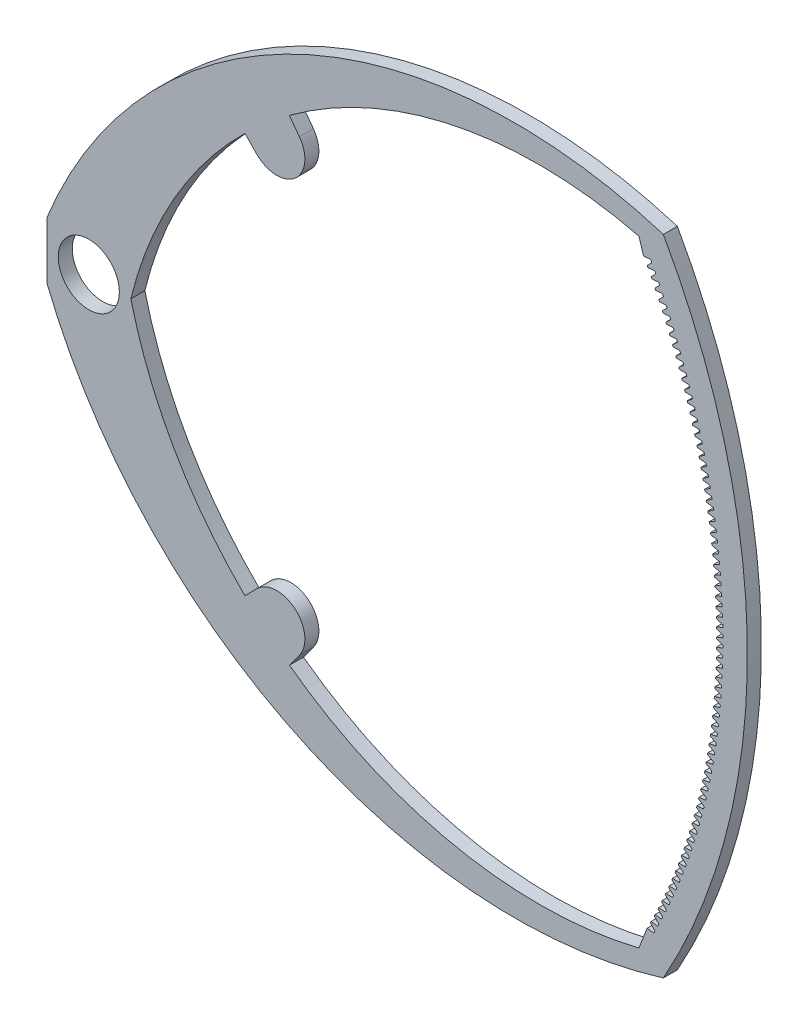
from build123d import *

# Parameters (mm, degrees)
SKETCH3_R           = 10.9
BOSS_EXTRUDE2_DEPTH = 5


with BuildPart() as part:
    # Sketch3 → Boss-Extrude2 (new body)
    with BuildSketch(Plane.XY):
        with BuildLine():
            Line((-15, -10), (-15, 10))
            ThreePointArc((-15, 10), (74.547676937, 105.343973254), (205.001324898, 114.888888889))
            ThreePointArc((205.001324898, 114.888888889), (235, 0), (205.001324898, -114.888888889))
            ThreePointArc((205.001324898, -114.888888889), (74.547676937, -105.343973254), (-15, -10))
        make_face()
        Circle(SKETCH3_R, mode=Mode.SUBTRACT)
        with BuildLine():
            Line((55.718333905, 71.437118146), (59.917032834, 67.150986171))
            ThreePointArc((59.917032834, 67.150986171), (73.578424615, 66.535062775), (75.141568824, 80.120701045))
            Line((75.141568824, 80.120701045), (71.577225561, 84.947237806))
            ThreePointArc((71.577225561, 84.947237806), (131.140675208, 111.345320133), (196.277864264, 110))
            Line((196.277864264, 110), (197.7802608, 105.161630064))
            ThreePointArc((197.7802608, 105.161630064), (197.927001001, 104.885186154), (198.073354808, 104.608537487))
            Line((198.073354808, 104.608537487), (200.443814177, 104.934931544))
            ThreePointArc((200.443814177, 104.934931544), (200.649821031, 104.540479338), (200.855051645, 104.145622705))
            Line((200.855051645, 104.145622705), (199.229267617, 102.389935661))
            ThreePointArc((199.229267617, 102.389935661), (199.372133755, 102.111469885), (199.514610677, 101.832804766))
            Line((199.514610677, 101.832804766), (201.889396156, 102.126070226))
            ThreePointArc((201.889396156, 102.126070226), (202.089875516, 101.728780165), (202.289573066, 101.331096554))
            Line((202.289573066, 101.331096554), (200.639434294, 99.598280137))
            ThreePointArc((200.639434294, 99.598280137), (200.778398516, 99.317846782), (200.916970777, 99.037219538))
            Line((200.916970777, 99.037219538), (203.295619397, 99.297299229))
            ThreePointArc((203.295619397, 99.297299229), (203.490532179, 98.897248765), (203.684657734, 98.496815705))
            Line((203.684657734, 98.496815705), (202.010485915, 96.787207732))
            ThreePointArc((202.010485915, 96.787207732), (202.14552113, 96.504861468), (202.280161716, 96.222326807))
            Line((202.280161716, 96.222326807), (204.662209754, 96.449170026))
            ThreePointArc((204.662209754, 96.449170026), (204.851517961, 96.04643715), (205.040033673, 95.643332707))
            Line((205.040033673, 95.643332707), (203.342155191, 93.957266468))
            ThreePointArc((203.342155191, 93.957266468), (203.473235075, 93.67306234), (203.603917736, 93.388675344))
            Line((203.603917736, 93.388675344), (205.988900808, 93.582237867))
            ThreePointArc((205.988900808, 93.582237867), (206.172567532, 93.176901092), (206.355436652, 92.771203851))
            Line((206.355436652, 92.771203851), (204.634182512, 91.109008049))
            ThreePointArc((204.634182512, 91.109008049), (204.761281509, 90.823001464), (204.887980769, 90.536817573))
            Line((204.887980769, 90.536817573), (207.275433917, 90.697061664))
            ThreePointArc((207.275433917, 90.697061664), (207.453423354, 90.289200012), (207.63061023, 89.880989066))
            Line((207.63061023, 89.880989066), (205.886315993, 88.242987748))
            ThreePointArc((205.886315993, 88.242987748), (206.009409325, 87.955234463), (206.132100485, 87.66730947))
            Line((206.132100485, 87.66730947), (208.52155827, 87.79420389))
            ThreePointArc((208.52155827, 87.79420389), (208.693835719, 87.383896874), (208.865305809, 86.973251803))
            Line((208.865305809, 86.973251803), (207.098311529, 85.359764302))
            ThreePointArc((207.098311529, 85.359764302), (207.2173752, 85.070320414), (207.336034339, 84.780710452))
            Line((207.336034339, 84.780710452), (209.727030932, 84.874230462))
            ThreePointArc((209.727030932, 84.874230462), (209.893562807, 84.461558073), (210.059282683, 84.048558933))
            Line((210.059282683, 84.048558933), (208.269932839, 82.459899801))
            ThreePointArc((208.269932839, 82.459899801), (208.384943636, 82.168821739), (208.499547622, 81.877583266))
            Line((208.499547622, 81.877583266), (210.891616894, 81.937710634))
            ThreePointArc((210.891616894, 81.937710634), (211.05237073, 81.522753323), (211.212308083, 81.10748063))
            Line((211.212308083, 81.10748063), (209.400951513, 79.543959579))
            ThreePointArc((209.400951513, 79.543959579), (209.511887014, 79.251304088), (209.622413505, 78.958493883))
            Line((209.622413505, 78.958493883), (212.015089117, 78.985216888))
            ThreePointArc((212.015089117, 78.985216888), (212.170033575, 78.56805555), (212.324157226, 78.150590262))
            Line((212.324157226, 78.150590262), (210.491147056, 76.612512105))
            ThreePointArc((210.491147056, 76.612512105), (210.597985635, 76.318336239), (210.704413084, 76.024011385))
            Line((210.704413084, 76.024011385), (213.097228578, 76.017324817))
            ThreePointArc((213.097228578, 76.017324817), (213.246333451, 75.59804078), (213.394613353, 75.178464283))
            Line((213.394613353, 75.178464283), (211.540306933, 73.666128869))
            ThreePointArc((211.540306933, 73.666128869), (211.643027762, 73.370489979), (211.745335419, 73.074707855))
            Line((211.745335419, 73.074707855), (214.137824313, 73.034613017))
            ThreePointArc((214.137824313, 73.034613017), (214.281060532, 72.613288022), (214.423467778, 72.191682112))
            Line((214.423467778, 72.191682112), (212.548226608, 70.705384276))
            ThreePointArc((212.548226608, 70.705384276), (212.646809661, 70.408339997), (212.744977582, 70.111158266))
            Line((212.744977582, 70.111158266), (215.136673454, 70.037662976))
            ThreePointArc((215.136673454, 70.037662976), (215.274013096, 69.614379159), (215.410519922, 69.19082603))
            Line((215.410519922, 69.19082603), (213.514709586, 67.730855528))
            ThreePointArc((213.514709586, 67.730855528), (213.609135643, 67.432463769), (213.70314469, 67.133940369))
            Line((213.70314469, 67.133940369), (216.093581275, 67.027058953))
            ThreePointArc((216.093581275, 67.027058953), (216.224997564, 66.601898835), (216.355577359, 66.17648106))
            Line((216.355577359, 66.17648106), (214.439567447, 64.743122516))
            ThreePointArc((214.439567447, 64.743122516), (214.5298181, 64.443441449), (214.619649947, 64.143634576))
            Line((214.619649947, 64.143634576), (217.008361224, 64.003387872))
            ThreePointArc((217.008361224, 64.003387872), (217.133828541, 63.576434339), (217.258455848, 63.149234854))
            Line((217.258455848, 63.149234854), (215.32261989, 61.742767703))
            ThreePointArc((215.32261989, 61.742767703), (215.408677545, 61.441855753), (215.494314678, 61.140823855))
            Line((215.494314678, 61.140823855), (217.880834962, 60.967239204))
            ThreePointArc((217.880834962, 60.967239204), (218.000328847, 60.538575492), (218.11897937, 60.109677579))
            Line((218.11897937, 60.109677579), (216.163694762, 58.730376016))
            ThreePointArc((216.163694762, 58.730376016), (216.245542641, 58.428291844), (216.326968364, 58.126093609))
            Line((216.326968364, 58.126093609), (218.710832401, 57.919204852))
            ThreePointArc((218.710832401, 57.919204852), (218.824329558, 57.488914529), (218.936980165, 57.058401803))
            Line((218.936980165, 57.058401803), (216.962628093, 55.706534725))
            ThreePointArc((216.962628093, 55.706534725), (217.04025024, 55.403337225), (217.11744868, 55.100031566))
            Line((217.11744868, 55.100031566), (219.498191729, 54.859879036))
            ThreePointArc((219.498191729, 54.859879036), (219.605670031, 54.428045988), (219.712298762, 53.996002379))
            Line((219.712298762, 53.996002379), (217.71926413, 52.671833335))
            ThreePointArc((217.71926413, 52.671833335), (217.792645413, 52.367581615), (217.865601519, 52.063227662))
            Line((217.865601519, 52.063227662), (220.24275945, 51.789858177))
            ThreePointArc((220.24275945, 51.789858177), (220.344197945, 51.356566592), (220.44478401, 50.923076327))
            Line((220.44478401, 50.923076327), (218.433455364, 49.626863467))
            ThreePointArc((218.433455364, 49.626863467), (218.502581477, 49.321616841), (218.571281028, 49.01627393))
            Line((218.571281028, 49.01627393), (220.944390408, 48.709740784))
            ThreePointArc((220.944390408, 48.709740784), (221.03976932, 48.275075131), (221.134293112, 47.84022272))
            Line((221.134293112, 47.84022272), (219.105062564, 46.572218743))
            ThreePointArc((219.105062564, 46.572218743), (219.16992003, 46.266036721), (219.234349632, 45.959764377))
            Line((219.234349632, 45.959764377), (221.60294782, 45.62012733))
            ThreePointArc((221.60294782, 45.62012733), (221.692248554, 45.184172349), (221.780691645, 44.748042568))
            Line((221.780691645, 44.748042568), (219.733954798, 43.508494673))
            ThreePointArc((219.733954798, 43.508494673), (219.794530974, 43.201436944), (219.854678065, 42.894294877))
            Line((219.854678065, 42.894294877), (222.218303298, 42.521620142))
            ThreePointArc((222.218303298, 42.521620142), (222.301508446, 42.084460823), (222.383853592, 41.647138695))
            Line((222.383853592, 41.647138695), (220.320009462, 40.436288536))
            ThreePointArc((220.320009462, 40.436288536), (220.376292538, 40.128414963), (220.432145393, 39.82046305))
            Line((220.432145393, 39.82046305), (222.790336877, 39.414823279))
            ThreePointArc((222.790336877, 39.414823279), (222.867430217, 38.976544848), (222.943661367, 38.538115631))
            Line((222.943661367, 38.538115631), (220.863112304, 37.356199264))
            ThreePointArc((220.863112304, 37.356199264), (220.915091307, 37.047569867), (220.966639037, 36.738868144))
            Line((220.966639037, 36.738868144), (223.318937039, 36.300342419))
            ThreePointArc((223.318937039, 36.300342419), (223.389903542, 35.861030318), (223.460005833, 35.421579484))
            Line((223.460005833, 35.421579484), (221.363157444, 34.268827328))
            ThreePointArc((221.363157444, 34.268827328), (221.410822241, 33.959502274), (221.458054798, 33.650110924))
            Line((221.458054798, 33.650110924), (223.804000732, 33.178784735))
            ThreePointArc((223.804000732, 33.178784735), (223.868826562, 32.738524609), (223.932786328, 32.298137831))
            Line((223.932786328, 32.298137831), (221.820047398, 31.174774615))
            ThreePointArc((221.820047398, 31.174774615), (221.863388696, 30.864814208), (221.906296872, 30.554793547))
            Line((221.906296872, 30.554793547), (224.245433391, 30.050758781))
            ThreePointArc((224.245433391, 30.050758781), (224.304105911, 29.609636461), (224.361910683, 29.168399591))
            Line((224.361910683, 29.168399591), (222.233693094, 28.074644318))
            ThreePointArc((222.233693094, 28.074644318), (222.272702445, 27.764108986), (222.311277873, 27.453519453))
            Line((222.311277873, 27.453519453), (224.643148959, 26.916874373))
            ThreePointArc((224.643148959, 26.916874373), (224.69565673, 26.474975854), (224.747295239, 26.032974914))
            Line((224.747295239, 26.032974914), (222.604013892, 24.969040814))
            ThreePointArc((222.604013892, 24.969040814), (222.63868369, 24.657991096), (222.672918851, 24.346893241))
            Line((222.672918851, 24.346893241), (224.997069899, 23.777742466))
            ThreePointArc((224.997069899, 23.777742466), (225.043402686, 23.335153899), (225.088864864, 22.892475057))
            Line((225.088864864, 22.892475057), (222.930937596, 21.858569546))
            ThreePointArc((222.930937596, 21.858569546), (222.961261082, 21.547066082), (222.991149302, 21.235520554))
            Line((222.991149302, 21.235520554), (225.307127215, 20.633975041))
            ThreePointArc((225.307127215, 20.633975041), (225.347275984, 20.19078271), (225.386552969, 19.747512267))
            Line((225.386552969, 19.747512267), (223.214400472, 18.743836906))
            ThreePointArc((223.214400472, 18.743836906), (223.240371735, 18.431940425), (223.265907186, 18.12000796))
            Line((223.265907186, 18.12000796), (225.57326046, 17.486184982))
            ThreePointArc((225.57326046, 17.486184982), (225.607217385, 17.042475287), (225.640301519, 16.59869966))
            Line((225.640301519, 16.59869966), (223.454347258, 15.625450119))
            ThreePointArc((223.454347258, 15.625450119), (223.475961234, 15.313221424), (223.497138939, 15.000962834))
            Line((223.497138939, 15.000962834), (225.795417752, 14.334985957))
            ThreePointArc((225.795417752, 14.334985957), (225.823176211, 13.8908454), (225.850061045, 13.446651104))
            Line((225.850061045, 13.446651104), (223.650731177, 12.504017118))
            ThreePointArc((223.650731177, 12.504017118), (223.667983653, 12.19151708), (223.684799483, 11.878993241))
            Line((223.684799483, 11.878993241), (225.973555779, 11.180992297))
            ThreePointArc((225.973555779, 11.180992297), (225.995110362, 10.736507465), (226.015790654, 10.291981097))
            Line((226.015790654, 10.291981097), (223.803513942, 9.380146435))
            ThreePointArc((223.803513942, 9.380146435), (223.816401555, 9.067435976), (223.828852231, 8.754707815))
            Line((223.828852231, 8.754707815), (226.107639813, 8.024818881))
            ThreePointArc((226.107639813, 8.024818881), (226.122986318, 7.580076426), (226.137458037, 7.135304647))
            Line((226.137458037, 7.135304647), (223.912665769, 6.254447074))
            ThreePointArc((223.912665769, 6.254447074), (223.921186005, 5.941587157), (223.929269101, 5.628715642))
            Line((223.929269101, 5.628715642), (226.197643715, 4.867081011))
            ThreePointArc((226.197643715, 4.867081011), (226.20677915, 4.422167637), (226.215039475, 3.977237155))
            Line((226.215039475, 3.977237155), (223.978165378, 3.127528396))
            ThreePointArc((223.978165378, 3.127528396), (223.982316577, 2.814580015), (223.986030517, 2.501626139))
            Line((223.986030517, 2.501626139), (226.243549939, 1.708394294))
            ThreePointArc((226.243549939, 1.708394294), (226.246472522, 1.263396738), (226.248519842, 0.818394294))
            Line((226.248519842, 0.818394294), (224, 0))
            ThreePointArc((224, 0), (223.999781353, -0.312975836), (223.999125412, -0.625951061))
            Line((223.999125412, -0.625951061), (226.245349534, -1.450625479))
            ThreePointArc((226.245349534, -1.450625479), (226.242058696, -1.895620464), (226.237892612, -2.340608116))
            Line((226.237892612, -2.340608116), (223.978165378, -3.127528396))
            ThreePointArc((223.978165378, -3.127528396), (223.973576927, -3.440470672), (223.968551234, -3.753406231))
            Line((223.968551234, -3.753406231), (226.20304215, -4.609362448))
            ThreePointArc((226.20304215, -4.609362448), (226.193538533, -5.05426811), (226.183159857, -5.499154219))
            Line((226.183159857, -5.499154219), (223.912665769, -6.254447074))
            ThreePointArc((223.912665769, -6.254447074), (223.903708409, -6.567294781), (223.894313942, -6.880129667))
            Line((223.894313942, -6.880129667), (226.116636034, -7.767200814))
            ThreePointArc((226.116636034, -7.767200814), (226.10092149, -8.211930417), (226.084332246, -8.656628251))
            Line((226.084332246, -8.656628251), (223.803513942, -9.380146435))
            ThreePointArc((223.803513942, -9.380146435), (223.790189419, -9.692838583), (223.776428011, -10.005511807))
            Line((223.776428011, -10.005511807), (225.986148033, -10.923524948))
            ThreePointArc((225.986148033, -10.923524948), (225.964225626, -11.367991791), (225.941429047, -11.812414656))
            Line((225.941429047, -11.812414656), (223.650731177, -12.504017118))
            ThreePointArc((223.650731177, -12.504017118), (223.633042088, -12.816492746), (223.614916422, -13.128943354))
            Line((223.614916422, -13.128943354), (225.811603584, -14.07771952))
            ThreePointArc((225.811603584, -14.07771952), (225.783477587, -14.521836954), (225.754478119, -14.965898208))
            Line((225.754478119, -14.965898208), (223.454347258, -15.625450119))
            ThreePointArc((223.454347258, -15.625450119), (223.432297053, -15.937648309), (223.409810662, -16.249815387))
            Line((223.409810662, -16.249815387), (225.593036715, -17.229169612))
            ThreePointArc((225.593036715, -17.229169612), (225.558712613, -17.672851055), (225.523515908, -18.116464128))
            Line((225.523515908, -18.116464128), (223.214400472, -18.743836906))
            ThreePointArc((223.214400472, -18.743836906), (223.187993449, -19.055696796), (223.161150716, -19.367519486))
            Line((223.161150716, -19.367519486), (225.330490037, -20.377260844))
            ThreePointArc((225.330490037, -20.377260844), (225.28997452, -20.820419799), (225.248587441, -21.263498207))
            Line((225.248587441, -21.263498207), (222.930937596, -21.858569546))
            ThreePointArc((222.930937596, -21.858569546), (222.900178903, -22.170030338), (222.868985062, -22.481447849))
            Line((222.868985062, -22.481447849), (225.024014734, -23.521379488))
            ThreePointArc((225.024014734, -23.521379488), (224.977315701, -23.963929561), (224.929746315, -24.406386926))
            Line((224.929746315, -24.406386926), (222.604013892, -24.969040814))
            ThreePointArc((222.604013892, -24.969040814), (222.568909525, -25.280041787), (222.533370658, -25.590993409))
            Line((222.533370658, -25.590993409), (224.673670553, -26.660912592))
            ThreePointArc((224.673670553, -26.660912592), (224.620797108, -27.102767507), (224.567054689, -27.544517571))
            Line((224.567054689, -27.544517571), (222.233693094, -28.074644318))
            ThreePointArc((222.233693094, -28.074644318), (222.194249898, -28.385124843), (222.154372932, -28.695549954))
            Line((222.154372932, -28.695549954), (224.279525795, -29.795248099))
            ThreePointArc((224.279525795, -29.795248099), (224.220488246, -30.236321715), (224.160583271, -30.677278357))
            Line((224.160583271, -30.677278357), (221.820047398, -31.174774615))
            ThreePointArc((221.820047398, -31.174774615), (221.776273061, -31.484674162), (221.732065771, -31.794512245))
            Line((221.732065771, -31.794512245), (223.841657299, -32.923774964))
            ThreePointArc((223.841657299, -32.923774964), (223.776467155, -33.363981292), (223.710411304, -33.804058548))
            Line((223.710411304, -33.804058548), (221.363157444, -34.268827328))
            ThreePointArc((221.363157444, -34.268827328), (221.315060501, -34.578085482), (221.266531505, -34.887276132))
            Line((221.266531505, -34.887276132), (223.360150428, -36.045883273))
            ThreePointArc((223.360150428, -36.045883273), (223.288820398, -36.485136495), (223.216626548, -36.92424857))
            Line((223.216626548, -36.92424857), (220.863112304, -37.356199264))
            ThreePointArc((220.863112304, -37.356199264), (220.810702131, -37.664755735), (220.757860889, -37.973238676))
            Line((220.757860889, -37.973238676), (222.835099053, -39.160964365))
            ThreePointArc((222.835099053, -39.160964365), (222.757643044, -39.599178848), (222.679325269, -40.037240137))
            Line((222.679325269, -40.037240137), (220.320009462, -40.436288536))
            ThreePointArc((220.320009462, -40.436288536), (220.263296277, -40.74408317), (220.206153092, -41.051798262))
            Line((220.206153092, -41.051798262), (222.266605534, -42.26841095))
            ThreePointArc((222.266605534, -42.26841095), (222.183038646, -42.705501263), (222.098612214, -43.142426364))
            Line((222.098612214, -43.142426364), (219.733954798, -43.508494673))
            ThreePointArc((219.733954798, -43.508494673), (219.672949657, -43.815467465), (219.611515668, -44.122354719))
            Line((219.611515668, -44.122354719), (221.6547807, -45.367617225))
            ThreePointArc((221.6547807, -45.367617225), (221.565119224, -45.803498156), (221.474600595, -46.239201891))
            Line((221.474600595, -46.239201891), (219.105062564, -46.572218743))
            ThreePointArc((219.105062564, -46.572218743), (219.03977736, -46.878309847), (218.974064545, -47.184309435))
            Line((218.974064545, -47.184309435), (220.999743828, -48.457978993))
            ThreePointArc((220.999743828, -48.457978993), (220.904005243, -48.892565566), (220.807412063, -49.326962993))
            Line((220.807412063, -49.326962993), (218.433455364, -49.626863467))
            ThreePointArc((218.433455364, -49.626863467), (218.363902825, -49.93201321), (218.293923993, -50.237065476))
            Line((218.293923993, -50.237065476), (220.301622617, -51.538893781))
            ThreePointArc((220.301622617, -51.538893781), (220.199825588, -51.972101274), (220.097176689, -52.405107705))
            Line((220.097176689, -52.405107705), (217.71926413, -52.671833335))
            ThreePointArc((217.71926413, -52.671833335), (217.645457814, -52.975982229), (217.571226609, -53.280027702))
            Line((217.571226609, -53.280027702), (219.560553169, -54.609760961))
            ThreePointArc((219.560553169, -54.609760961), (219.452717542, -55.041504917), (219.344032934, -55.473035939))
            Line((219.344032934, -55.473035939), (216.962628093, -55.706534725))
            ThreePointArc((216.962628093, -55.706534725), (216.884582389, -56.009623474), (216.806113283, -56.312602882))
            Line((216.806113283, -56.312602882), (218.776679956, -57.669981859))
            ThreePointArc((218.776679956, -57.669981859), (218.662826753, -58.10017811), (218.548127625, -58.530149594))
            Line((218.548127625, -58.530149594), (216.163694762, -58.730376016))
            ThreePointArc((216.163694762, -58.730376016), (216.081424886, -59.032345533), (215.998733175, -59.334199807))
            Line((215.998733175, -59.334199807), (217.950155795, -60.71895988))
            ThreePointArc((217.950155795, -60.71895988), (217.830307213, -61.147524558), (217.709615926, -61.57585268))
            Line((217.709615926, -61.57585268), (215.32261989, -61.742767703))
            ThreePointArc((215.32261989, -61.742767703), (215.236141881, -62.043559119), (215.149243687, -62.344229413))
            Line((215.149243687, -62.344229413), (217.08114182, -63.756100619))
            ThreePointArc((217.08114182, -63.756100619), (216.955321223, -64.182950175), (216.828661306, -64.609551432))
            Line((216.828661306, -64.609551432), (214.439567447, -64.743122516))
            ThreePointArc((214.439567447, -64.743122516), (214.348898164, -65.04267719), (214.257810427, -65.342104887))
            Line((214.257810427, -65.342104887), (216.169807446, -66.78081198))
            ThreePointArc((216.169807446, -66.78081198), (216.038039363, -67.205863199), (215.905435509, -67.630654424))
            Line((215.905435509, -67.630654424), (213.514709586, -67.730855528))
            ThreePointArc((213.514709586, -67.730855528), (213.419866704, -68.029115062), (213.324607182, -68.327241789))
            Line((213.324607182, -68.327241789), (215.21633034, -69.79250429))
            ThreePointArc((215.21633034, -69.79250429), (215.078640459, -70.215674307), (214.940118519, -70.638572685))
            Line((214.940118519, -70.638572685), (212.548226608, -70.705384276))
            ThreePointArc((212.548226608, -70.705384276), (212.449228618, -71.002290524), (212.349815883, -71.29905816))
            Line((212.349815883, -71.29905816), (214.220896384, -72.790590413))
            ThreePointArc((214.220896384, -72.790590413), (214.077311548, -73.21179673), (213.932898527, -73.632719818))
            Line((213.932898527, -73.632719818), (211.540306933, -73.666128869))
            ThreePointArc((211.540306933, -73.666128869), (211.437173134, -73.961623948), (211.333626566, -74.256974638))
            Line((211.333626566, -74.256974638), (213.183699639, -75.774485865))
            ThreePointArc((213.183699639, -75.774485865), (213.034247841, -76.193646368), (212.883971893, -76.612512105))
            Line((212.883971893, -76.612512105), (210.491147056, -76.612512105))
            ThreePointArc((210.491147056, -76.612512105), (210.383897555, -76.906538407), (210.27623734, -77.200414572))
            Line((210.27623734, -77.200414572), (212.10494231, -78.743608932))
            ThreePointArc((212.10494231, -78.743608932), (211.949652685, -79.160641903), (211.793543107, -79.577368631))
            Line((211.793543107, -79.577368631), (209.400951513, -79.543959579))
            ThreePointArc((209.400951513, -79.543959579), (209.289607217, -79.836459784), (209.177854345, -80.128804131))
            Line((209.177854345, -80.128804131), (210.984834702, -81.697380776))
            ThreePointArc((210.984834702, -81.697380776), (210.823737525, -82.112204915), (210.66182475, -82.526711392))
            Line((210.66182475, -82.526711392), (208.269932839, -82.459899801))
            ThreePointArc((208.269932839, -82.459899801), (208.154515456, -82.750816885), (208.038691713, -83.041572422))
            Line((208.038691713, -83.041572422), (209.823595183, -84.635225554))
            ThreePointArc((209.823595183, -84.635225554), (209.656721859, -85.047759989), (209.489037452, -85.459965407))
            Line((209.489037452, -85.459965407), (207.098311529, -85.359764302))
            ThreePointArc((207.098311529, -85.359764302), (206.97884356, -85.64904155), (206.858971526, -85.938151594))
            Line((206.858971526, -85.938151594), (208.621450138, -87.556570527))
            ThreePointArc((208.621450138, -87.556570527), (208.4488332, -87.966734835), (208.275409852, -88.376558832))
            Line((208.275409852, -88.376558832), (205.886315993, -88.242987748))
            ThreePointArc((205.886315993, -88.242987748), (205.762820728, -88.530568765), (205.638923772, -88.817976953))
            Line((205.638923772, -88.817976953), (207.378633928, -90.460846173))
            ThreePointArc((207.378633928, -90.460846173), (207.200307028, -90.868560391), (207.021178548, -91.275923072))
            Line((207.021178548, -91.275923072), (204.634182512, -91.109008049))
            ThreePointArc((204.634182512, -91.109008049), (204.506684027, -91.394836771), (204.378786302, -91.680487071))
            Line((204.378786302, -91.680487071), (206.095388842, -93.347486298))
            ThreePointArc((206.095388842, -93.347486298), (205.911386746, -93.752670941), (205.726588055, -94.15749289))
            Line((205.726588055, -94.15749289), (203.342155191, -93.957266468))
            ThreePointArc((203.342155191, -93.957266468), (203.210678342, -94.241287171), (203.078804784, -94.525123896))
            Line((203.078804784, -94.525123896), (204.771965052, -96.215928145))
            ThreePointArc((204.771965052, -96.215928145), (204.58232363, -96.618504222), (204.391890756, -97.020706518))
            Line((204.391890756, -97.020706518), (202.010485915, -96.787207732))
            ThreePointArc((202.010485915, -96.787207732), (201.875056333, -97.069365046), (201.73923265, -97.351332862))
            Line((201.73923265, -97.351332862), (203.408620561, -99.065612506))
            ThreePointArc((203.408620561, -99.065612506), (203.213376785, -99.465501534), (203.017346853, -99.865005767))
            Line((203.017346853, -99.865005767), (200.639434294, -99.598280137))
            ThreePointArc((200.639434294, -99.598280137), (200.500078382, -99.878519056), (200.360331052, -100.158562992))
            Line((200.360331052, -100.158562992), (202.005621157, -101.895983831))
            ThreePointArc((202.005621157, -101.895983831), (201.80481309, -102.29310785), (201.603224316, -102.689836135))
            Line((201.603224316, -102.689836135), (199.229267617, -102.389935661))
            Line((199.229267617, -102.389935661), (196.277864264, -110))
            ThreePointArc((196.277864264, -110), (131.140675208, -111.345320133), (71.577225561, -84.947237806))
            Line((71.577225561, -84.947237806), (75.141568824, -80.120701045))
            ThreePointArc((75.141568824, -80.120701045), (73.578424615, -66.535062775), (59.917032834, -67.150986171))
            Line((59.917032834, -67.150986171), (55.718333905, -71.437118146))
            ThreePointArc((55.718333905, -71.437118146), (30.368570356, -38.563141608), (15, 0))
            ThreePointArc((15, 0), (30.368570356, 38.563141608), (55.718333905, 71.437118146))
        make_face(mode=Mode.SUBTRACT)
    extrude(amount=BOSS_EXTRUDE2_DEPTH)


solid = part.part
